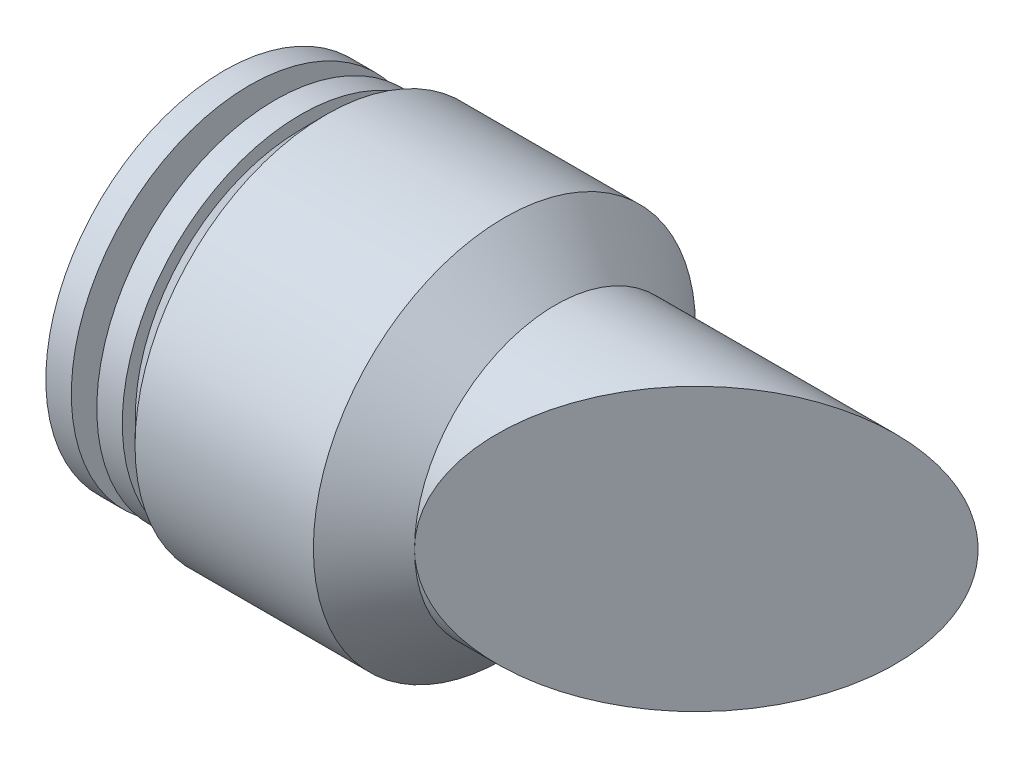
from build123d import *
from build123d.topology import SkipClean

# Parameters (mm, degrees)
SKETCH_2_R               = 3
CUT_EXTRUDE_1_DEPTH      = 6
CUT_EXTRUDE_2_DEPTH      = 20.756862782
CUT_EXTRUDE_2_DEPTH_BACK = 20.756862782


with BuildPart() as part:
    # Эскиз1 → Повернуть1 (revolve)
    with BuildSketch(Plane.XY):
        Polygon((-9.432089165, 2.077253219), (-9.432089165, 9.077253219), (-8.432089165, 9.077253219), (-8.432089165, 6.077253219), (-7.432089165, 6.077253219), (-7.432089165, 9.077253219), (-6.432089165, 9.077253219), (-6.432089165, 8.562024792), (-5.432089165, 9.577253219), (1.567910835, 9.577253219), (3.567910835, 7.607253219), (15.567910835, 7.607253219), (15.567910835, 2.077253219), align=None)
    revolve(axis=Axis((15.567910835, 2.077253219, 0), (-1, 0, 0)))

    # Эскиз2 → Вырез-Вытянуть1 (cut)
    with BuildSketch(Plane.ZY.offset(9.432089165)):
        with Locations(Location((0, 2.077253219, 0), (0, 0, 270))):
            Circle(SKETCH_2_R)
    extrude(amount=-CUT_EXTRUDE_1_DEPTH, mode=Mode.SUBTRACT)

    # Эскиз3 → Вырез-Вытянуть2 (cut, two sides: drawn at the far end of the back side and taken through both)
    with SkipClean():  # the faces are left unmerged after this step: merging them gives an invalid solid
        with BuildSketch(Plane(origin=(0, 0, 0), x_dir=(1, 0, 0), z_dir=(0, 1, 0)).offset(-CUT_EXTRUDE_2_DEPTH_BACK)):
            Polygon((3.567910835, -5.53), (14.748858559, 5.650947724), (16.371941026, 5.650947724), (16.371941026, -6.819604623), (3.567910835, -5.789196512), align=None)
        extrude(amount=CUT_EXTRUDE_2_DEPTH + CUT_EXTRUDE_2_DEPTH_BACK, mode=Mode.SUBTRACT)


solid = part.part
